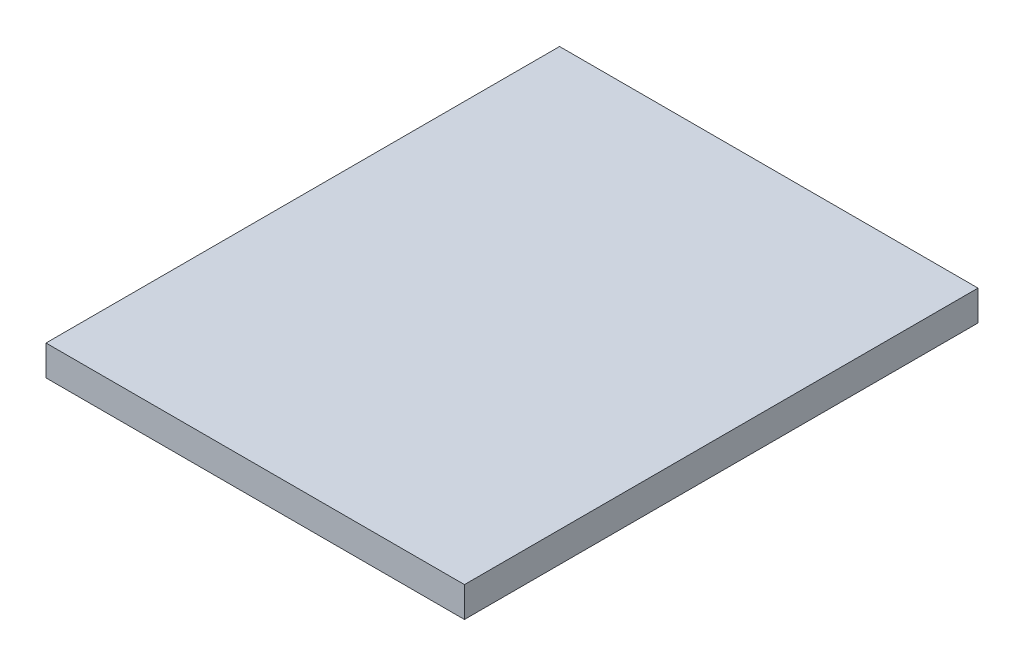
from build123d import *

# Parameters (mm, degrees)
SKETCH1_W           = 44
SKETCH1_H           = 54
BOSS_EXTRUDE1_DEPTH = 3.18


with BuildPart() as part:
    # Sketch1 → Boss-Extrude1 (new body)
    with BuildSketch(Plane(origin=(0, 0, 0), x_dir=(1, 0, 0), z_dir=(0, 1, 0))):
        Rectangle(SKETCH1_W, SKETCH1_H)
    extrude(amount=BOSS_EXTRUDE1_DEPTH)


solid = part.part
